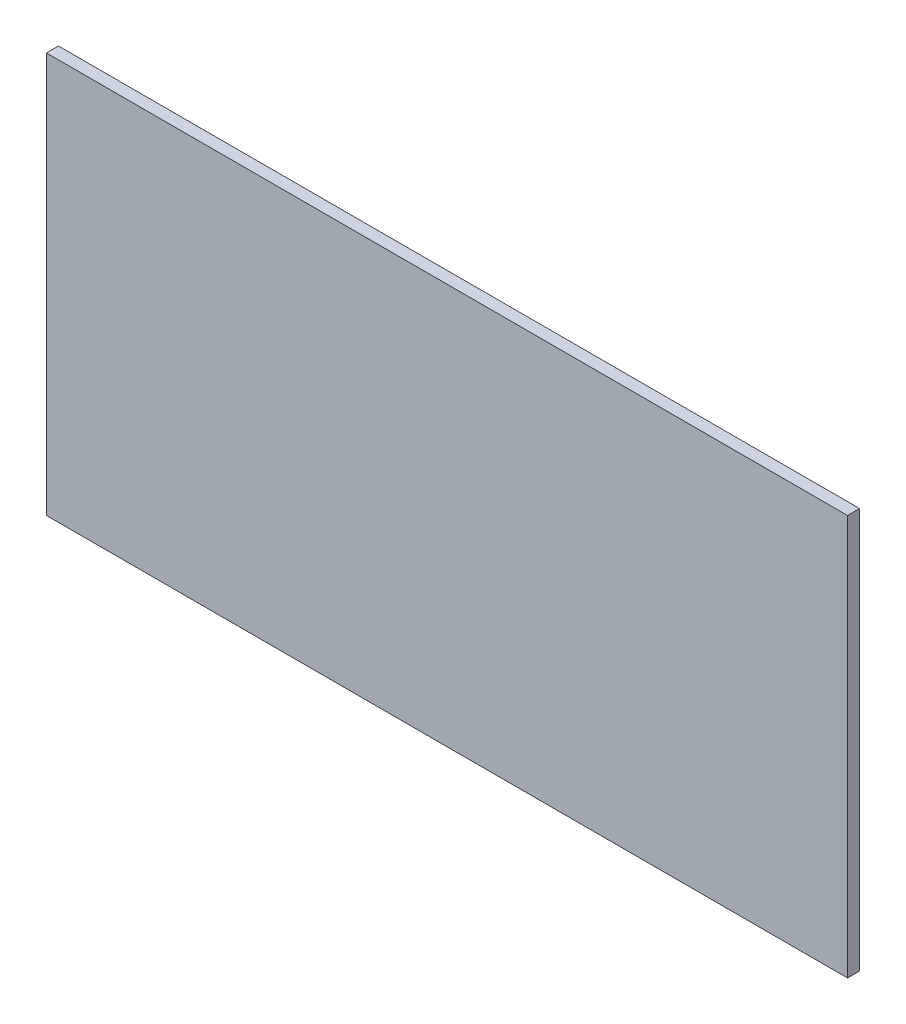
from build123d import *

# Parameters (mm, degrees)
SKETCH_1_W      = 200
SKETCH_1_H      = 100
ABOT_BASE_DEPTH = 3


with BuildPart() as part:
    # Эскиз1 → abot_base (new body)
    with BuildSketch(Plane.XY):
        Rectangle(SKETCH_1_W, SKETCH_1_H)
    extrude(amount=ABOT_BASE_DEPTH)


solid = part.part
